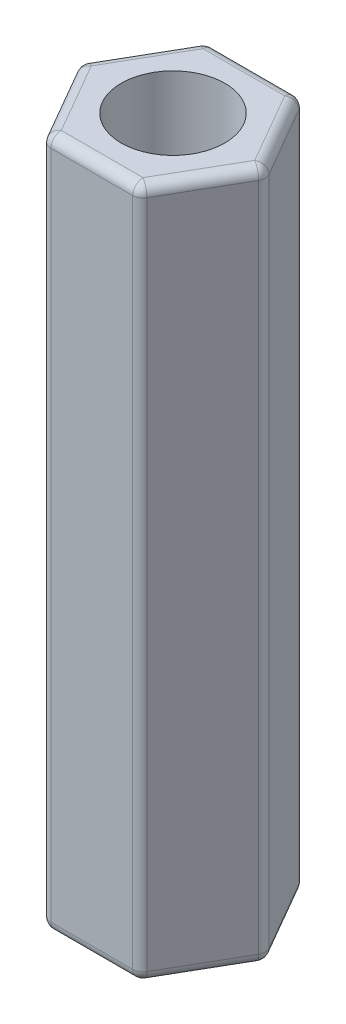
from build123d import *

# Parameters (mm, degrees)
SKETCH_1_R      = 1.5
EXTRUDE_1_DEPTH = 20
FILLET_1_R      = 0.3


with BuildPart() as part:
    # 草图1 → 凸台-拉伸1 (new body)
    with BuildSketch(Plane(origin=(0, 0, 0), x_dir=(1, 0, 0), z_dir=(0, 1, 0))):
        Polygon((2.713546265, 0), (1.356773133, 2.35), (-1.356773133, 2.35), (-2.713546265, 0), (-1.356773133, -2.35), (1.356773133, -2.35), align=None)
        with Locations(Location((0, 0, 0), (0, 0, 270))):
            Circle(SKETCH_1_R, mode=Mode.SUBTRACT)
    extrude(amount=EXTRUDE_1_DEPTH)

    # 圆角1
    fillet_1_edges = [part.edges().sort_by_distance(p)[0] for p in [
        (0, 20, -2.35),
        (1.356773133, 10, 2.35),
        (-1.356773133, 10, 2.35),
        (-2.713546265, 10, 0),
        (-1.356773133, 10, -2.35),
        (1.356773133, 10, -2.35),
        (2.713546265, 10, 0),
        (-2.035159699, 20, -1.175),
        (-2.035159699, 20, 1.175),
        (0, 20, 2.35),
        (2.035159699, 20, 1.175),
        (0, 0, 2.35),
        (-2.035159699, 0, 1.175),
        (-2.035159699, 0, -1.175),
        (2.035159699, 20, -1.175),
        (0, 0, -2.35),
        (2.035159699, 0, -1.175),
        (2.035159699, 0, 1.175),
    ]]
    fillet(fillet_1_edges, radius=FILLET_1_R)


solid = part.part
